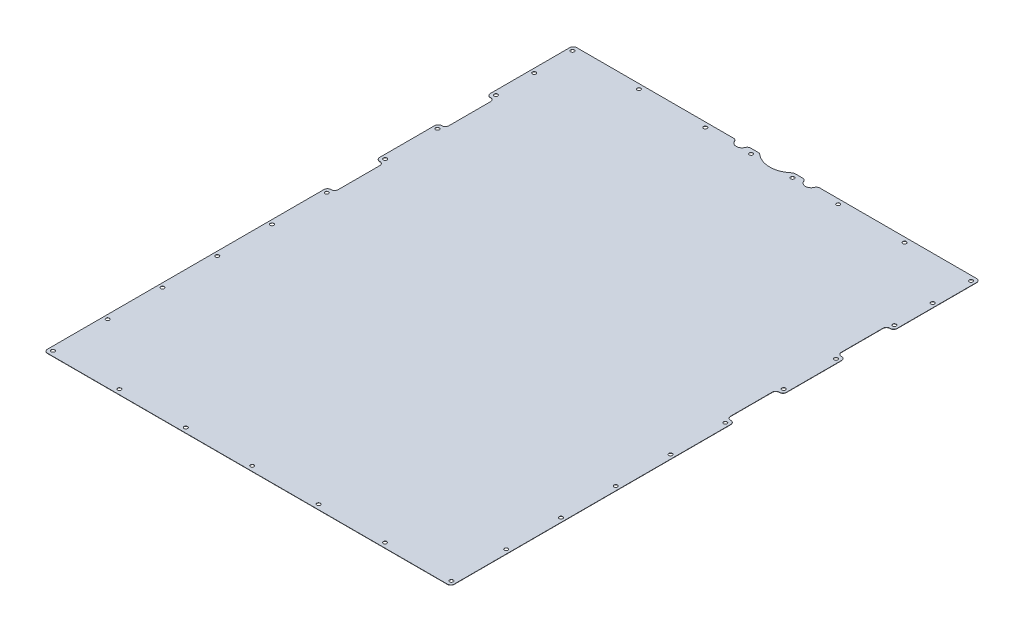
from build123d import *

# Parameters (mm, degrees)
SKETCH1_W                       = 373.38
SKETCH1_H                       = 485.775
BOSS_EXTRUDE1_DEPTH             = 0.254
SKETCH2_W                       = 6.604
SKETCH2_H                       = 44.704
CUT_EXTRUDE1_DEPTH              = 307.345488415
FILLET1_R                       = 3.175
F_4_CLEARANCE_HOLE1_AT_2_COUNT  = 2
F_4_CLEARANCE_HOLE1_AT_2_PITCH  = 70.358
F_4_CLEARANCE_HOLE1_AT_3_COUNT  = 2
F_4_CLEARANCE_HOLE1_AT_3_PITCH  = 35.179
F_4_CLEARANCE_HOLE1_AT_4_COUNT  = 2
F_4_CLEARANCE_HOLE1_AT_4_PITCH  = 123.952
F_4_CLEARANCE_HOLE1_AT_5_COUNT  = 2
F_4_CLEARANCE_HOLE1_AT_5_PITCH  = 171.958
F_4_CLEARANCE_HOLE1_AT_6_COUNT  = 2
F_4_CLEARANCE_HOLE1_AT_6_PITCH  = 225.552
F_4_CLEARANCE_HOLE1_AT_7_COUNT  = 2
F_4_CLEARANCE_HOLE1_AT_7_PITCH  = 275.8186
F_4_CLEARANCE_HOLE1_AT_8_COUNT  = 2
F_4_CLEARANCE_HOLE1_AT_8_PITCH  = 326.0852
F_4_CLEARANCE_HOLE1_AT_9_COUNT  = 2
F_4_CLEARANCE_HOLE1_AT_9_PITCH  = 376.3518
F_4_CLEARANCE_HOLE1_AT_10_COUNT = 2
F_4_CLEARANCE_HOLE1_AT_10_PITCH = 426.6184
F_4_CLEARANCE_HOLE1_AT_11_COUNT = 2
F_4_CLEARANCE_HOLE1_AT_11_PITCH = 476.885
F_4_CLEARANCE_HOLE1_AT_12_COUNT = 2
F_4_CLEARANCE_HOLE1_AT_12_PITCH = 527.1516
F_4_CLEARANCE_HOLE2_AT_2_COUNT  = 2
F_4_CLEARANCE_HOLE2_AT_2_PITCH  = 60.96
F_4_CLEARANCE_HOLE2_AT_3_COUNT  = 2
F_4_CLEARANCE_HOLE2_AT_3_PITCH  = 121.92
F_4_CLEARANCE_HOLE2_AT_4_COUNT  = 2
F_4_CLEARANCE_HOLE2_AT_4_PITCH  = 182.88
F_4_CLEARANCE_HOLE2_AT_5_COUNT  = 2
F_4_CLEARANCE_HOLE2_AT_5_PITCH  = 243.84
CUT_EXTRUDE2_REACH              = 308.345
SKETCH7_R                       = 22.225
FILLET2_R                       = 3.175
F_4_CLEARANCE_HOLE3_D           = 3.2639
SKETCH10_R                      = 5.334
CUT_EXTRUDE3_DEPTH              = 1.016
FILLET3_R                       = 3.175


with BuildPart() as part:
    # Sketch1 → Boss-Extrude1 (new body)
    with BuildSketch(Plane(origin=(0, 0, 0), x_dir=(1, 0, 0), z_dir=(0, 1, 0))):
        Rectangle(SKETCH1_W, SKETCH1_H)
    extrude(amount=BOSS_EXTRUDE1_DEPTH)

    # Sketch2 → Cut-Extrude1 (cut, through all)
    with BuildSketch(Plane(origin=(0, 0.254, 0), x_dir=(1, 0, 0), z_dir=(0, 1, 0))):
        with Locations((-183.388, 141.2875)):
            Rectangle(SKETCH2_W, SKETCH2_H)
        with Locations((-183.388, 39.6875)):
            Rectangle(SKETCH2_W, SKETCH2_H)
    cut_extrude1 = extrude(amount=-CUT_EXTRUDE1_DEPTH, mode=Mode.SUBTRACT)

    # Mirror1: Cut-Extrude1 across plane
    add(cut_extrude1.mirror(Plane(origin=(0, 0, 0), x_dir=(0, 0, 1), z_dir=(1, 0, 0))), mode=Mode.SUBTRACT)

    # Fillet1
    fillet1_edges = [part.edges().sort_by_distance(p)[0] for p in [
        (-186.69, 0.127, -118.9355),
        (-186.69, 0.127, -163.6395),
        (-180.086, 0.127, -163.6395),
        (-180.086, 0.127, -118.9355),
        (-180.086, 0.127, -62.0395),
        (-180.086, 0.127, -17.3355),
        (-186.69, 0.127, -17.3355),
        (-186.69, 0.127, -62.0395),
        (186.69, 0.127, -163.6395),
        (186.69, 0.127, -118.9355),
        (180.086, 0.127, -118.9355),
        (180.086, 0.127, -163.6395),
        (180.086, 0.127, -17.3355),
        (180.086, 0.127, -62.0395),
        (186.69, 0.127, -62.0395),
        (186.69, 0.127, -17.3355),
        (186.69, 0.127, 242.8875),
        (-186.69, 0.127, 242.8875),
        (-186.69, 0.127, -242.8875),
        (186.69, 0.127, -242.8875),
    ]]
    fillet(fillet1_edges, radius=FILLET1_R)

    # Sketch3 → #4 Clearance Hole1 (revolve, cut)
    with BuildSketch(Plane(origin=(-182.88, 0.254, -238.4425), x_dir=(0, 0, 1), z_dir=(1, 0, 0))):
        Polygon((0, 0), (0, 1.742574487), (1.63195, 0.762), (1.63195, 0), align=None)
    f_4_clearance_hole1 = revolve(axis=Axis((-182.88, 6.604, -238.4425), (0, -1, 0)), mode=Mode.SUBTRACT)

    # #4 Clearance Hole1 at 2: #4 Clearance Hole1 ×2
    with Locations(*[(0, 0, i * F_4_CLEARANCE_HOLE1_AT_2_PITCH) for i in range(1, F_4_CLEARANCE_HOLE1_AT_2_COUNT)]):
        add(f_4_clearance_hole1, mode=Mode.SUBTRACT)

    # #4 Clearance Hole1 at 3: #4 Clearance Hole1 ×2
    with Locations(*[(0, 0, i * F_4_CLEARANCE_HOLE1_AT_3_PITCH) for i in range(1, F_4_CLEARANCE_HOLE1_AT_3_COUNT)]):
        add(f_4_clearance_hole1, mode=Mode.SUBTRACT)

    # #4 Clearance Hole1 at 4: #4 Clearance Hole1 ×2
    with Locations(*[(0, 0, i * F_4_CLEARANCE_HOLE1_AT_4_PITCH) for i in range(1, F_4_CLEARANCE_HOLE1_AT_4_COUNT)]):
        add(f_4_clearance_hole1, mode=Mode.SUBTRACT)

    # #4 Clearance Hole1 at 5: #4 Clearance Hole1 ×2
    with Locations(*[(0, 0, i * F_4_CLEARANCE_HOLE1_AT_5_PITCH) for i in range(1, F_4_CLEARANCE_HOLE1_AT_5_COUNT)]):
        add(f_4_clearance_hole1, mode=Mode.SUBTRACT)

    # #4 Clearance Hole1 at 6: #4 Clearance Hole1 ×2
    with Locations(*[(0, 0, i * F_4_CLEARANCE_HOLE1_AT_6_PITCH) for i in range(1, F_4_CLEARANCE_HOLE1_AT_6_COUNT)]):
        add(f_4_clearance_hole1, mode=Mode.SUBTRACT)

    # #4 Clearance Hole1 at 7: #4 Clearance Hole1 ×2
    with Locations(*[(0, 0, i * F_4_CLEARANCE_HOLE1_AT_7_PITCH) for i in range(1, F_4_CLEARANCE_HOLE1_AT_7_COUNT)]):
        add(f_4_clearance_hole1, mode=Mode.SUBTRACT)

    # #4 Clearance Hole1 at 8: #4 Clearance Hole1 ×2
    with Locations(*[(0, 0, i * F_4_CLEARANCE_HOLE1_AT_8_PITCH) for i in range(1, F_4_CLEARANCE_HOLE1_AT_8_COUNT)]):
        add(f_4_clearance_hole1, mode=Mode.SUBTRACT)

    # #4 Clearance Hole1 at 9: #4 Clearance Hole1 ×2
    with Locations(*[(0, 0, i * F_4_CLEARANCE_HOLE1_AT_9_PITCH) for i in range(1, F_4_CLEARANCE_HOLE1_AT_9_COUNT)]):
        add(f_4_clearance_hole1, mode=Mode.SUBTRACT)

    # #4 Clearance Hole1 at 10: #4 Clearance Hole1 ×2
    with Locations(*[(0, 0, i * F_4_CLEARANCE_HOLE1_AT_10_PITCH) for i in range(1, F_4_CLEARANCE_HOLE1_AT_10_COUNT)]):
        add(f_4_clearance_hole1, mode=Mode.SUBTRACT)

    # #4 Clearance Hole1 at 11: #4 Clearance Hole1 ×2
    with Locations(*[(0, 0, i * F_4_CLEARANCE_HOLE1_AT_11_PITCH) for i in range(1, F_4_CLEARANCE_HOLE1_AT_11_COUNT)]):
        add(f_4_clearance_hole1, mode=Mode.SUBTRACT)

    # #4 Clearance Hole1 at 12: #4 Clearance Hole1 ×2
    with Locations(*[(0, 0, i * F_4_CLEARANCE_HOLE1_AT_12_PITCH) for i in range(1, F_4_CLEARANCE_HOLE1_AT_12_COUNT)]):
        add(f_4_clearance_hole1, mode=Mode.SUBTRACT)

    # Mirror2: #4 Clearance Hole1 across plane
    add(f_4_clearance_hole1.mirror(Plane(origin=(0, 0, 0), x_dir=(0, 0, 1), z_dir=(1, 0, 0))), mode=Mode.SUBTRACT)

    # Mirror2 copy 1 sketch → Mirror2 copy 1 (revolve, cut)
    with BuildSketch(Plane(origin=(182.88, 0.254, -168.0845), x_dir=(0, 0, 1), z_dir=(-1, 0, 0))):
        Polygon((0, 0), (0, -1.742574487), (1.63195, -0.762), (1.63195, 0), align=None)
    revolve(axis=Axis((182.88, 6.604, -168.0845), (0, 1, 0)), mode=Mode.SUBTRACT)

    # Mirror2 copy 2 sketch → Mirror2 copy 2 (revolve, cut)
    with BuildSketch(Plane(origin=(182.88, 0.254, -203.2635), x_dir=(0, 0, 1), z_dir=(-1, 0, 0))):
        Polygon((0, 0), (0, -1.742574487), (1.63195, -0.762), (1.63195, 0), align=None)
    revolve(axis=Axis((182.88, 6.604, -203.2635), (0, 1, 0)), mode=Mode.SUBTRACT)

    # Mirror2 copy 3 sketch → Mirror2 copy 3 (revolve, cut)
    with BuildSketch(Plane(origin=(182.88, 0.254, -114.4905), x_dir=(0, 0, 1), z_dir=(-1, 0, 0))):
        Polygon((0, 0), (0, -1.742574487), (1.63195, -0.762), (1.63195, 0), align=None)
    revolve(axis=Axis((182.88, 6.604, -114.4905), (0, 1, 0)), mode=Mode.SUBTRACT)

    # Mirror2 copy 4 sketch → Mirror2 copy 4 (revolve, cut)
    with BuildSketch(Plane(origin=(182.88, 0.254, -66.4845), x_dir=(0, 0, 1), z_dir=(-1, 0, 0))):
        Polygon((0, 0), (0, -1.742574487), (1.63195, -0.762), (1.63195, 0), align=None)
    revolve(axis=Axis((182.88, 6.604, -66.4845), (0, 1, 0)), mode=Mode.SUBTRACT)

    # Mirror2 copy 5 sketch → Mirror2 copy 5 (revolve, cut)
    with BuildSketch(Plane(origin=(182.88, 0.254, -12.8905), x_dir=(0, 0, 1), z_dir=(-1, 0, 0))):
        Polygon((0, 0), (0, -1.742574487), (1.63195, -0.762), (1.63195, 0), align=None)
    revolve(axis=Axis((182.88, 6.604, -12.8905), (0, 1, 0)), mode=Mode.SUBTRACT)

    # Mirror2 copy 6 sketch → Mirror2 copy 6 (revolve, cut)
    with BuildSketch(Plane(origin=(182.88, 0.254, 37.3761), x_dir=(0, 0, 1), z_dir=(-1, 0, 0))):
        Polygon((0, 0), (0, -1.742574487), (1.63195, -0.762), (1.63195, 0), align=None)
    revolve(axis=Axis((182.88, 6.604, 37.3761), (0, 1, 0)), mode=Mode.SUBTRACT)

    # Mirror2 copy 7 sketch → Mirror2 copy 7 (revolve, cut)
    with BuildSketch(Plane(origin=(182.88, 0.254, 87.6427), x_dir=(0, 0, 1), z_dir=(-1, 0, 0))):
        Polygon((0, 0), (0, -1.742574487), (1.63195, -0.762), (1.63195, 0), align=None)
    revolve(axis=Axis((182.88, 6.604, 87.6427), (0, 1, 0)), mode=Mode.SUBTRACT)

    # Mirror2 copy 8 sketch → Mirror2 copy 8 (revolve, cut)
    with BuildSketch(Plane(origin=(182.88, 0.254, 137.9093), x_dir=(0, 0, 1), z_dir=(-1, 0, 0))):
        Polygon((0, 0), (0, -1.742574487), (1.63195, -0.762), (1.63195, 0), align=None)
    revolve(axis=Axis((182.88, 6.604, 137.9093), (0, 1, 0)), mode=Mode.SUBTRACT)

    # Mirror2 copy 9 sketch → Mirror2 copy 9 (revolve, cut)
    with BuildSketch(Plane(origin=(182.88, 0.254, 188.1759), x_dir=(0, 0, 1), z_dir=(-1, 0, 0))):
        Polygon((0, 0), (0, -1.742574487), (1.63195, -0.762), (1.63195, 0), align=None)
    revolve(axis=Axis((182.88, 6.604, 188.1759), (0, 1, 0)), mode=Mode.SUBTRACT)

    # Mirror2 copy 10 sketch → Mirror2 copy 10 (revolve, cut)
    with BuildSketch(Plane(origin=(182.88, 0.254, 238.4425), x_dir=(0, 0, 1), z_dir=(-1, 0, 0))):
        Polygon((0, 0), (0, -1.742574487), (1.63195, -0.762), (1.63195, 0), align=None)
    revolve(axis=Axis((182.88, 6.604, 238.4425), (0, 1, 0)), mode=Mode.SUBTRACT)

    # Mirror2 copy 11 sketch → Mirror2 copy 11 (revolve, cut)
    with BuildSketch(Plane(origin=(182.88, 0.254, 288.7091), x_dir=(0, 0, 1), z_dir=(-1, 0, 0))):
        Polygon((0, 0), (0, -1.742574487), (1.63195, -0.762), (1.63195, 0), align=None)
    revolve(axis=Axis((182.88, 6.604, 288.7091), (0, 1, 0)), mode=Mode.SUBTRACT)

    # Sketch5 → #4 Clearance Hole2 (revolve, cut)
    with BuildSketch(Plane(origin=(-121.92, 0.254, -238.4425), x_dir=(0, 0, 1), z_dir=(1, 0, 0))):
        Polygon((0, 0), (0, 1.742574487), (1.63195, 0.762), (1.63195, 0), align=None)
    f_4_clearance_hole2 = revolve(axis=Axis((-121.92, 6.604, -238.4425), (0, -1, 0)), mode=Mode.SUBTRACT)

    # #4 Clearance Hole2 at 2: #4 Clearance Hole2 ×2
    with Locations(*[(i * F_4_CLEARANCE_HOLE2_AT_2_PITCH, 0, 0) for i in range(1, F_4_CLEARANCE_HOLE2_AT_2_COUNT)]):
        add(f_4_clearance_hole2, mode=Mode.SUBTRACT)

    # #4 Clearance Hole2 at 3: #4 Clearance Hole2 ×2
    with Locations(*[(i * F_4_CLEARANCE_HOLE2_AT_3_PITCH, 0, 0) for i in range(1, F_4_CLEARANCE_HOLE2_AT_3_COUNT)]):
        add(f_4_clearance_hole2, mode=Mode.SUBTRACT)

    # #4 Clearance Hole2 at 4: #4 Clearance Hole2 ×2
    with Locations(*[(i * F_4_CLEARANCE_HOLE2_AT_4_PITCH, 0, 0) for i in range(1, F_4_CLEARANCE_HOLE2_AT_4_COUNT)]):
        add(f_4_clearance_hole2, mode=Mode.SUBTRACT)

    # #4 Clearance Hole2 at 5: #4 Clearance Hole2 ×2
    with Locations(*[(i * F_4_CLEARANCE_HOLE2_AT_5_PITCH, 0, 0) for i in range(1, F_4_CLEARANCE_HOLE2_AT_5_COUNT)]):
        add(f_4_clearance_hole2, mode=Mode.SUBTRACT)

    # Mirror3: #4 Clearance Hole2 across plane
    add(f_4_clearance_hole2.mirror(Plane.XY), mode=Mode.SUBTRACT)

    # Mirror3 copy 1 sketch → Mirror3 copy 1 (revolve, cut)
    with BuildSketch(Plane(origin=(-60.96, 0.254, 238.4425), x_dir=(0, 0, -1), z_dir=(1, 0, 0))):
        Polygon((0, 0), (0, -1.742574487), (1.63195, -0.762), (1.63195, 0), align=None)
    revolve(axis=Axis((-60.96, 6.604, 238.4425), (0, 1, 0)), mode=Mode.SUBTRACT)

    # Mirror3 copy 2 sketch → Mirror3 copy 2 (revolve, cut)
    with BuildSketch(Plane(origin=(0, 0.254, 238.4425), x_dir=(0, 0, -1), z_dir=(1, 0, 0))):
        Polygon((0, 0), (0, -1.742574487), (1.63195, -0.762), (1.63195, 0), align=None)
    revolve(axis=Axis((0, 6.604, 238.4425), (0, 1, 0)), mode=Mode.SUBTRACT)

    # Mirror3 copy 3 sketch → Mirror3 copy 3 (revolve, cut)
    with BuildSketch(Plane(origin=(60.96, 0.254, 238.4425), x_dir=(0, 0, -1), z_dir=(1, 0, 0))):
        Polygon((0, 0), (0, -1.742574487), (1.63195, -0.762), (1.63195, 0), align=None)
    revolve(axis=Axis((60.96, 6.604, 238.4425), (0, 1, 0)), mode=Mode.SUBTRACT)

    # Mirror3 copy 4 sketch → Mirror3 copy 4 (revolve, cut)
    with BuildSketch(Plane(origin=(121.92, 0.254, 238.4425), x_dir=(0, 0, -1), z_dir=(1, 0, 0))):
        Polygon((0, 0), (0, -1.742574487), (1.63195, -0.762), (1.63195, 0), align=None)
    revolve(axis=Axis((121.92, 6.604, 238.4425), (0, 1, 0)), mode=Mode.SUBTRACT)

    # Sketch7 → Cut-Extrude2 (cut, up to next)
    with BuildSketch(Plane(origin=(0, 0.254, 0), x_dir=(1, 0, 0), z_dir=(0, 1, 0)), mode=Mode.PRIVATE) as cut_extrude2_sk1:
        with Locations((0, 258.7625)):
            Circle(SKETCH7_R)
    cut_extrude2_tool1 = extrude(cut_extrude2_sk1.sketch, amount=-CUT_EXTRUDE2_REACH, mode=Mode.PRIVATE) & part.part
    add(cut_extrude2_tool1.solids().sort_by_distance((0, 0.254, -258.7625))[0], mode=Mode.SUBTRACT)

    # Fillet2
    fillet2_edges = [part.edges().sort_by_distance(p)[0] for p in [
        (15.554259867, 0.127, -242.8875),
        (-15.554259867, 0.127, -242.8875),
    ]]
    fillet(fillet2_edges, radius=FILLET2_R)

    # #4 Clearance Hole3 (through all)
    with Locations(Plane(origin=(0, 0.254, 0), x_dir=(-1, 0, 0), z_dir=(0, 1, 0))):
        with Locations((19.05, -238.4425), (-19.05, -238.4425)):
            Hole(F_4_CLEARANCE_HOLE3_D / 2)

    # Sketch10 → Cut-Extrude3 (cut)
    with BuildSketch(Plane(origin=(0, 0.254, 0), x_dir=(1, 0, 0), z_dir=(0, 1, 0))):
        with Locations((31.75, 242.8875)):
            Circle(SKETCH10_R)
        with Locations((-31.75, 242.8875)):
            Circle(SKETCH10_R)
    extrude(amount=-CUT_EXTRUDE3_DEPTH, mode=Mode.SUBTRACT)

    # Fillet3
    fillet3_edges = [part.edges().sort_by_distance(p)[0] for p in [
        (37.084, 0.127, -242.8875),
        (26.416, 0.127, -242.8875),
        (-37.084, 0.127, -242.8875),
        (-26.416, 0.127, -242.8875),
    ]]
    fillet(fillet3_edges, radius=FILLET3_R)


solid = part.part
